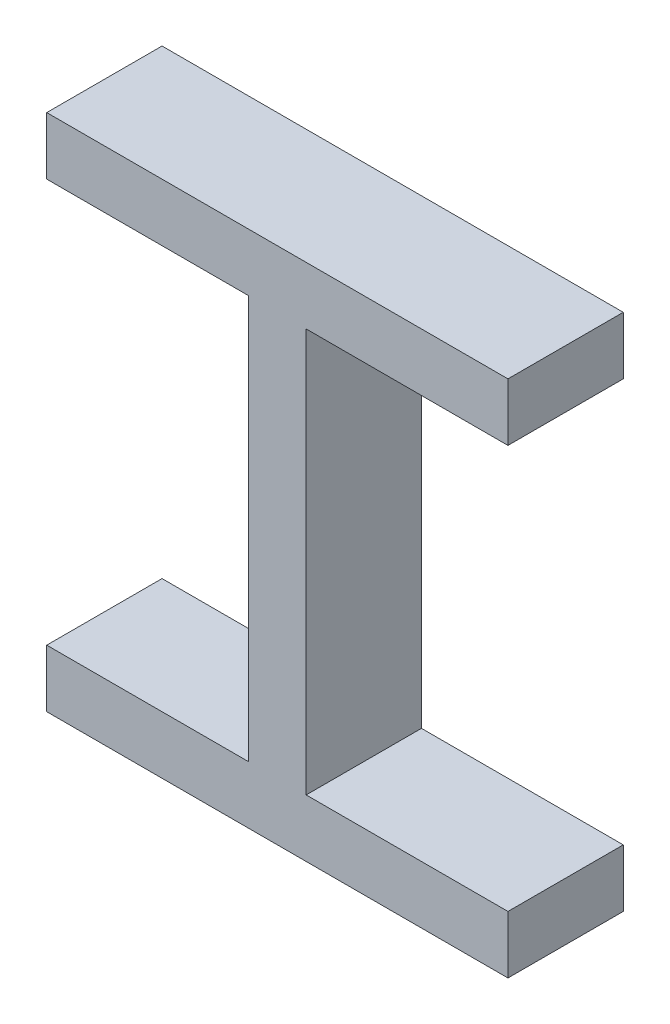
from build123d import *

# Parameters (mm, degrees)
BOSS_EXTRUDE1_DEPTH = 40


with BuildPart() as part:
    # Sketch1 → Boss-Extrude1 (new body)
    with BuildSketch(Plane.XY):
        Polygon((90, -20), (160, -20), (160, 0), (0, 0), (0, -20), (70, -20), (70, -160), (0, -160), (0, -180), (160, -180), (160, -160), (90, -160), align=None)
    extrude(amount=BOSS_EXTRUDE1_DEPTH)


solid = part.part
